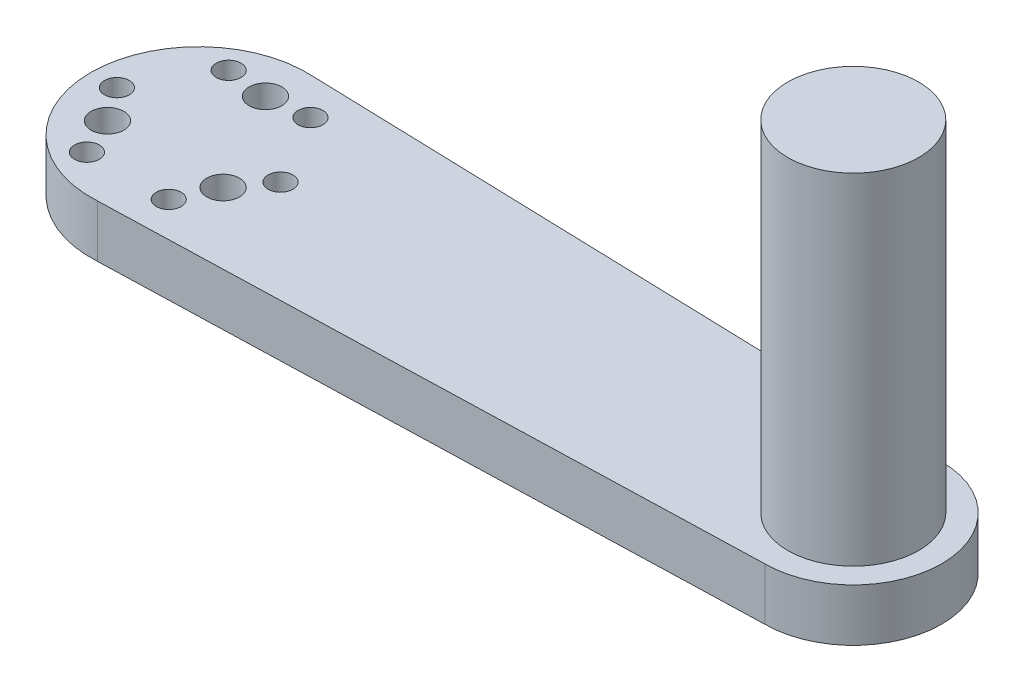
from build123d import *

# Parameters (mm, degrees)
SKETCH_1_R               = 16.5
EXTRUDE_1_DEPTH          = 8
CUT_EXTRUDE_1_DEPTH      = 25.667792767
CUT_EXTRUDE_1_DEPTH_BACK = 25.667792767
SKETCH_4_R               = 2.5
SKETCH_4_R_2             = 1.9
SKETCH_1_3_R             = 10
EXTRUDE_2_DEPTH          = 8
EXTRUDE_3_DEPTH          = 60


with BuildPart() as part:
    # 草图1 → 凸台-拉伸1 (new body)
    with BuildSketch(Plane(origin=(0, 0, 0), x_dir=(1, 0, 0), z_dir=(0, 1, 0))):
        Circle(SKETCH_1_R)
    extrude(amount=EXTRUDE_1_DEPTH)

    # 草图4 → 切除-拉伸1 (cut, two sides: drawn at the far end of the back side and taken through both)
    with BuildSketch(Plane(origin=(0, 8, 0), x_dir=(1, 0, 0), z_dir=(0, 1, 0)).offset(-CUT_EXTRUDE_1_DEPTH_BACK)):
        with Locations((0, 10.2)):
            Circle(SKETCH_4_R)
        with Locations((-6.25, 10.825317547)):
            Circle(SKETCH_4_R_2)
        with Locations((6.25, 10.825317547)):
            Circle(SKETCH_4_R_2)
        with Locations((12.5, 0)):
            Circle(SKETCH_4_R_2)
        with Locations((6.25, -10.825317547)):
            Circle(SKETCH_4_R_2)
        with Locations((-6.25, -10.825317547)):
            Circle(SKETCH_4_R_2)
        with Locations((-12.5, 0)):
            Circle(SKETCH_4_R_2)
        with Locations((8.833459119, -5.1)):
            Circle(SKETCH_4_R)
        with Locations((-8.833459119, -5.1)):
            Circle(SKETCH_4_R)
    extrude(amount=CUT_EXTRUDE_1_DEPTH + CUT_EXTRUDE_1_DEPTH_BACK, mode=Mode.SUBTRACT)

    # 草图1<3> → 凸台-拉伸2 (add)
    with BuildSketch(Plane(origin=(0, 0, 0), x_dir=(1, 0, 0), z_dir=(0, 1, 0))):
        with BuildLine():
            ThreePointArc((0.989109801, 16.470326706), (16.5, 0), (0.989109801, -16.470326706))
            Line((0.989109801, -16.470326706), (100, -13.5))
            ThreePointArc((100, -13.5), (113.5, 0), (100, 13.5))
            Line((100, 13.5), (0.989109801, 16.470326706))
        make_face()
        with Locations((100, 0)):
            Circle(SKETCH_1_3_R, mode=Mode.SUBTRACT)
    extrude(amount=EXTRUDE_2_DEPTH)

    # 草图1<4> → 凸台-拉伸3 (add)
    with BuildSketch(Plane(origin=(0, 0, 0), x_dir=(1, 0, 0), z_dir=(0, 1, 0))):
        with BuildLine():
            ThreePointArc((110, 0), (100, 10), (90, 0))
            ThreePointArc((90, 0), (100, -10), (110, 0))
        make_face()
    extrude(amount=EXTRUDE_3_DEPTH)


solid = part.part
